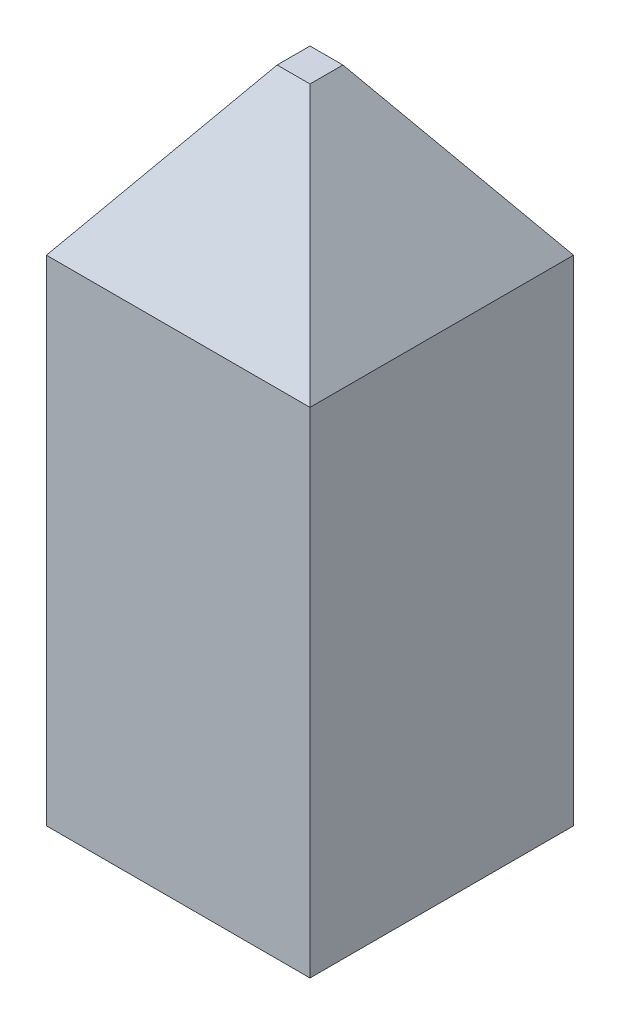
from build123d import *

# Parameters (mm, degrees)
SKETCH1_W           = 0.4
SKETCH1_H           = 0.4
BOSS_EXTRUDE1_DEPTH = 0.75
SKETCH2_W           = 0.4
SKETCH2_H           = 0.4
BOSS_EXTRUDE2_DEPTH = 0.25
BOSS_EXTRUDE2_TAPER = 35


with BuildPart() as part:
    # Sketch1 → Boss-Extrude1 (new body)
    with BuildSketch(Plane(origin=(0, 0, 0), x_dir=(1, 0, 0), z_dir=(0, 1, 0))):
        Rectangle(SKETCH1_W, SKETCH1_H)
    extrude(amount=BOSS_EXTRUDE1_DEPTH)

    # Sketch2 → Boss-Extrude2 (add)
    with BuildSketch(Plane(origin=(0, 0.75, 0), x_dir=(1, 0, 0), z_dir=(0, 1, 0))):
        Rectangle(SKETCH2_W, SKETCH2_H)
    extrude(amount=BOSS_EXTRUDE2_DEPTH, taper=BOSS_EXTRUDE2_TAPER)


solid = part.part
